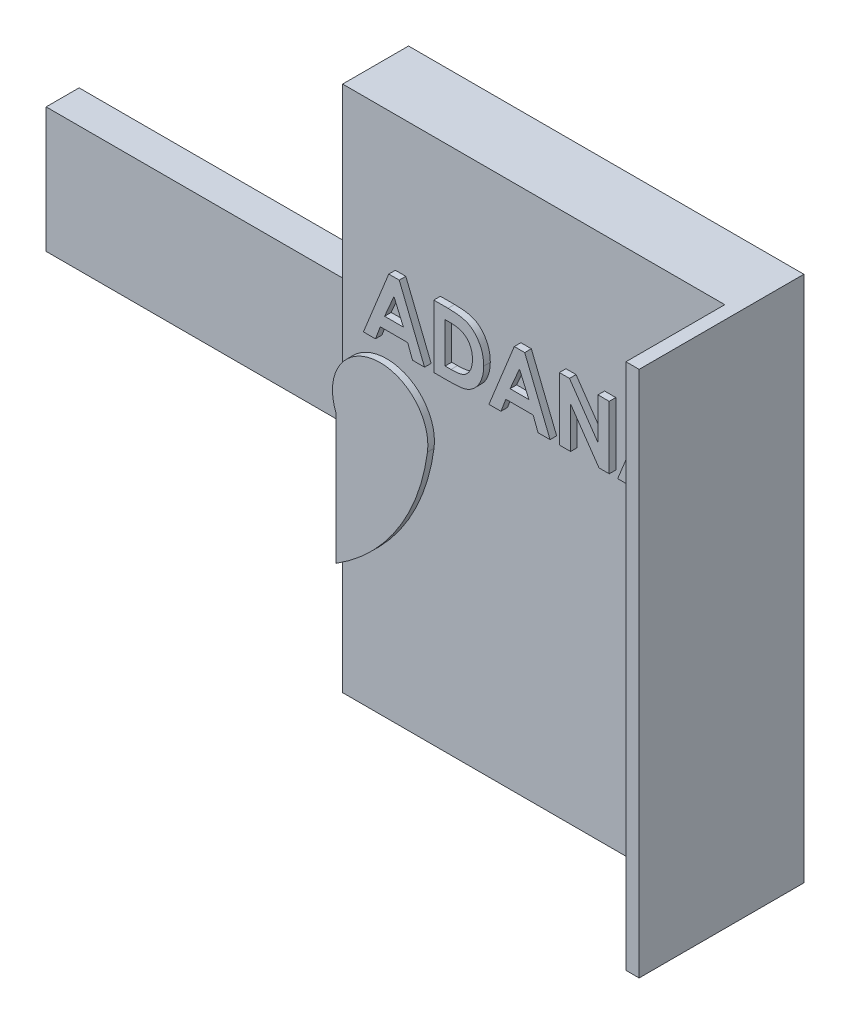
from build123d import *

# Parameters (mm, degrees)
IZIM1_W                     = 60
IZIM1_H                     = 80
Y_KSEKLIK_EKSTR_ZYON1_DEPTH = 10
IZIM2_W                     = 5
IZIM2_H                     = 19
Y_KSEKLIK_EKSTR_ZYON2_DEPTH = 50
IZIM3_W                     = 15
IZIM3_H                     = 80
Y_KSEKLIK_EKSTR_ZYON3_DEPTH = 2
Y_KSEKLIK_EKSTR_ZYON4_DEPTH = 1


with BuildPart() as part:
    # Çizim1 → Yükseklik-Ekstrüzyon1 (new body)
    with BuildSketch(Plane.XY):
        Rectangle(IZIM1_W, IZIM1_H)
    extrude(amount=Y_KSEKLIK_EKSTR_ZYON1_DEPTH)

    # Çizim2 → Yükseklik-Ekstrüzyon2 (add)
    with BuildSketch(Plane(origin=(-30, 0, 0), x_dir=(0, 0, -1), z_dir=(1, 0, 0))):
        with Locations((-2.5, 0)):
            Rectangle(IZIM2_W, IZIM2_H)
    extrude(amount=-Y_KSEKLIK_EKSTR_ZYON2_DEPTH)

    # Çizim3 → Yükseklik-Ekstrüzyon3 (add)
    with BuildSketch(Plane(origin=(30, 0, 0), x_dir=(0, 0, -1), z_dir=(1, 0, 0))):
        with Locations((-17.5, 0)):
            Rectangle(IZIM3_W, IZIM3_H)
    extrude(amount=-Y_KSEKLIK_EKSTR_ZYON3_DEPTH)

    # Çizim4 → Yükseklik-Ekstrüzyon4 (add)
    # profile 1 of 6: a face of its own
    with BuildSketch(Plane.XY.offset(10)):
        with BuildLine():
            Line((-30, -2.758821569), (-30, -22.5))
            ThreePointArc((-30, -22.5), (-20.644812954, -13.276725535), (-16.127578533, -0.940481791))
            ThreePointArc((-16.127578533, -0.940481791), (-24.247174638, 7.178595313), (-30, -2.758821569))
        make_face()
    # profile 2 of 6: a face of its own
    with BuildSketch(Plane.XY.offset(10)):
        Polygon((-21.999298336, 19.525), (-20.413706389, 19.525), (-16.567071773, 10), (-18.393078384, 10), (-19.133402903, 11.953846154), (-23.283417927, 11.953846154), (-24.023742447, 10), (-25.847841004, 10), align=None)
        Polygon((-21.207456389, 16.970117188), (-22.634679947, 13.663461538), (-19.780232831, 13.663461538), align=None, mode=Mode.SUBTRACT)
    # profile 3 of 6: a face of its own
    with BuildSketch(Plane.XY.offset(10)):
        with BuildLine():
            Line((-15.16274485, 19.525), (-13.008553144, 19.525))
            add(Edge.make_bspline(
                [(-13.008553144, 19.525), (-12.840609123, 19.523826014), (-12.515971431, 19.521556685), (-12.04563564, 19.49598681), (-11.608283206, 19.456662156), (-11.203632202, 19.402563969), (-10.832512229, 19.330977253), (-10.495401839, 19.241185748), (-10.191169607, 19.137536394), (-9.916479691, 19.015571895), (-9.665714218, 18.873373403), (-9.427604398, 18.714975699), (-9.202617755, 18.534576213), (-8.987596956, 18.335655209), (-8.78531689, 18.11457349), (-8.592408871, 17.874992969), (-8.41359616, 17.613439399), (-8.243473638, 17.336184009), (-8.089620454, 17.042051817), (-7.955423958, 16.733546416), (-7.843006739, 16.412653152), (-7.751661928, 16.079030037), (-7.678849571, 15.733784598), (-7.627904232, 15.376220162), (-7.596409316, 15.006667774), (-7.59321442, 14.756203976), (-7.591591004, 14.628936298)],
                knots=[0, 0, 0, 0, 1.44355588, 2.790409838, 4.047694926, 5.217575253, 6.298404546, 7.294384826, 8.214239204, 9.058592145, 9.873746385, 10.689560431, 11.514393297, 12.350027578, 13.205127629, 14.088021785, 14.991911688, 15.926770944, 16.882954281, 17.842803888, 18.816321264, 19.80318086, 20.814351908, 21.847355356, 22.906180909, 24, 24, 24, 24], degree=3))
            add(Edge.make_bspline(
                [(-7.591591004, 14.628936298), (-7.595841984, 14.449353321), (-7.604210287, 14.095833719), (-7.674700195, 13.577047775), (-7.788706245, 13.079739705), (-7.949009105, 12.607799646), (-8.14774174, 12.165430293), (-8.385150126, 11.760432644), (-8.657753303, 11.394980521), (-8.962375429, 11.070893577), (-9.292207001, 10.792336456), (-9.634968515, 10.553772666), (-9.993999093, 10.365645212), (-10.310355209, 10.246344273), (-10.584675428, 10.172149411), (-10.825525613, 10.128299533), (-11.099106848, 10.08808655), (-11.407970042, 10.057010822), (-11.750760277, 10.029298909), (-12.12884392, 10.014241334), (-12.540996845, 10.001730724), (-12.827276021, 10.000592025), (-12.976116245, 10)],
                knots=[0, 0, 0, 0, 1.315458931, 2.589557908, 3.828601765, 5.048913369, 6.235739168, 7.376350998, 8.481830359, 9.569842114, 10.627874879, 11.640079404, 12.624025415, 13.590060155, 14.111227486, 14.704434459, 15.382649715, 16.137166398, 16.978595427, 17.902333227, 18.909396075, 20, 20, 20, 20], degree=3))
            Line((-12.976116245, 10), (-15.16274485, 10))
            Line((-15.16274485, 10), (-15.16274485, 19.525))
        make_face()
        with BuildLine():
            Line((-13.453129466, 17.815384615), (-13.453129466, 11.709615385))
            Line((-13.453129466, 11.709615385), (-12.560160716, 11.709615385))
            add(Edge.make_bspline(
                [(-12.560160716, 11.709615385), (-12.453911148, 11.709810078), (-12.24955786, 11.710184538), (-11.954517968, 11.728020382), (-11.681680879, 11.745922652), (-11.431797647, 11.779901759), (-11.203049701, 11.817752093), (-10.998579438, 11.870426015), (-10.814171838, 11.925755509), (-10.652079405, 11.996196811), (-10.503615942, 12.075483186), (-10.366155734, 12.168376365), (-10.233468148, 12.271530737), (-10.108033884, 12.387980219), (-9.989378205, 12.516182801), (-9.878203152, 12.656799054), (-9.773024833, 12.809399953), (-9.676542976, 12.974792337), (-9.588377338, 13.151229626), (-9.510164538, 13.337002767), (-9.445314586, 13.53365885), (-9.391415276, 13.739356938), (-9.352898107, 13.955887866), (-9.321032497, 14.181647819), (-9.304604846, 14.41753124), (-9.302350253, 14.578034203), (-9.301206389, 14.659465144)],
                knots=[0, 0, 0, 0, 1.50275155, 2.890291501, 4.180787663, 5.369391935, 6.45668281, 7.458360028, 8.354766181, 9.177074746, 9.954075863, 10.732690366, 11.5210699, 12.329727389, 13.151100085, 13.990027547, 14.863562427, 15.770965086, 16.696477834, 17.652329173, 18.619756807, 19.62365428, 20.657822005, 21.729286259, 22.847956731, 24, 24, 24, 24], degree=3))
            add(Edge.make_bspline(
                [(-9.301206389, 14.659465144), (-9.303484578, 14.784250364), (-9.307926871, 15.027571875), (-9.350767379, 15.381974966), (-9.420503555, 15.715698568), (-9.520010358, 16.027504143), (-9.645441767, 16.318268029), (-9.802448416, 16.58552684), (-9.984273341, 16.833770156), (-10.12805553, 16.97939765), (-10.199899298, 17.052163462)],
                knots=[0, 0, 0, 0, 1.13821349, 2.219428113, 3.251817212, 4.244760574, 5.201143372, 6.134805572, 7.068016741, 8, 8, 8, 8], degree=3))
            add(Edge.make_bspline(
                [(-10.199899298, 17.052163462), (-10.270744054, 17.11416977), (-10.415436449, 17.240810634), (-10.669468745, 17.392558776), (-10.949399178, 17.525884392), (-11.261631718, 17.631596738), (-11.603148776, 17.715198567), (-11.975984434, 17.772856704), (-12.378142077, 17.809907212), (-12.656747521, 17.813519698), (-12.800575379, 17.815384615)],
                knots=[0, 0, 0, 0, 0.813307809, 1.661089106, 2.549956539, 3.493439533, 4.508053171, 5.589449661, 6.755572447, 8, 8, 8, 8], degree=3))
            Line((-12.800575379, 17.815384615), (-13.453129466, 17.815384615))
        make_face(mode=Mode.SUBTRACT)
    # profile 4 of 6: a face of its own
    with BuildSketch(Plane.XY.offset(10)):
        Polygon((-2.949298336, 19.525), (-1.363706389, 19.525), (2.482928227, 10), (0.656921616, 10), (-0.083402903, 11.953846154), (-4.233417927, 11.953846154), (-4.973742447, 10), (-6.797841004, 10), align=None)
        Polygon((-2.157456389, 16.970117188), (-3.584679947, 13.663461538), (-0.730232831, 13.663461538), align=None, mode=Mode.SUBTRACT)
    # profile 5 of 6: a face of its own
    with BuildSketch(Plane.XY.offset(10)):
        Polygon((3.88725515, 19.525), (5.427053827, 19.525), (9.748793611, 13.257046274), (9.748793611, 19.525), (11.458408996, 19.525), (11.458408996, 10), (9.907162001, 10), (5.596870534, 16.248873197), (5.596870534, 10), (3.88725515, 10), align=None)
    # profile 6 of 6: a face of its own
    with BuildSketch(Plane.XY.offset(10)):
        Polygon((16.589163202, 19.525), (18.17475515, 19.525), (22.021389765, 10), (20.195383154, 10), (19.455058635, 11.953846154), (15.305043611, 11.953846154), (14.564719092, 10), (12.740620534, 10), align=None)
        Polygon((17.38100515, 16.970117188), (15.953781592, 13.663461538), (18.808228707, 13.663461538), align=None, mode=Mode.SUBTRACT)
    extrude(amount=Y_KSEKLIK_EKSTR_ZYON4_DEPTH)


solid = part.part
